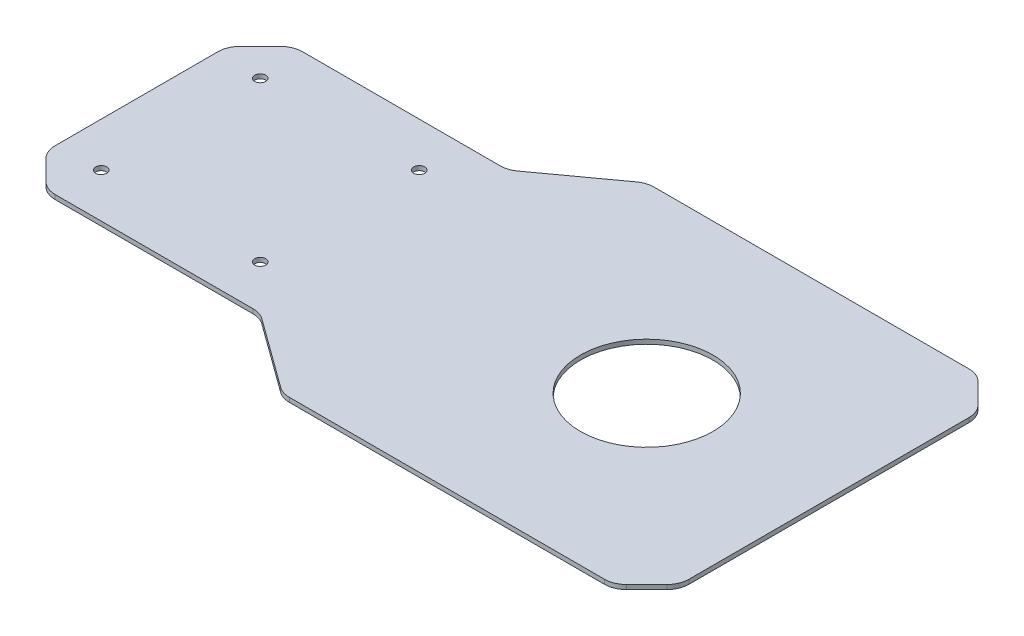
from build123d import *

# Parameters (mm, degrees)
BOSS_EXTRUDE1_DEPTH = 2
CHAMFER1_SIZE       = 15
FILLET1_R           = 10
SKETCH3_R           = 2.5
SKETCH3_R_2         = 30
CUT_EXTRUDE1_DEPTH  = 271.400628697


with BuildPart() as part:
    # Sketch2 → Boss-Extrude1 (new body)
    with BuildSketch(Plane(origin=(0, 0, 0), x_dir=(1, 0, 0), z_dir=(0, 1, 0))):
        Polygon((56, 56), (92.5, 82.5), (257.5, 82.5), (257.5, -82.5), (92.5, -82.5), (56, -56), (-56, -56), (-56, 56), align=None)
    extrude(amount=BOSS_EXTRUDE1_DEPTH)

    # Chamfer1
    chamfer1_edges = [part.edges().sort_by_distance(p)[0] for p in [
        (257.5, 1, 82.5),
        (-56, 1, 56),
        (-56, 1, -56),
        (257.5, 1, -82.5),
    ]]
    chamfer(chamfer1_edges, length=CHAMFER1_SIZE)

    # Fillet1
    fillet1_edges = [part.edges().sort_by_distance(p)[0] for p in [
        (92.5, 1, 82.5),
        (56, 1, 56),
        (56, 1, -56),
        (92.5, 1, -82.5),
        (-56, 1, 41),
        (-56, 1, -41),
        (-41, 1, -56),
        (-41, 1, 56),
        (242.5, 1, -82.5),
        (257.5, 1, 67.5),
        (257.5, 1, -67.5),
        (242.5, 1, 82.5),
    ]]
    fillet(fillet1_edges, radius=FILLET1_R)

    # Sketch3 → Cut-Extrude1 (cut, through all)
    with BuildSketch(Plane(origin=(0, 2, 0), x_dir=(1, 0, 0), z_dir=(0, 1, 0))):
        with Locations(Location((36, 36, 0), (0, 0, 270))):
            Circle(SKETCH3_R)
        with Locations(Location((-36, 36, 0), (0, 0, 270))):
            Circle(SKETCH3_R)
        with Locations(Location((-36, -36, 0), (0, 0, 270))):
            Circle(SKETCH3_R)
        with Locations(Location((36, -36, 0), (0, 0, 270))):
            Circle(SKETCH3_R)
        with Locations(Location((175, 0, 0), (0, 0, 270))):
            Circle(SKETCH3_R_2)
    extrude(amount=-CUT_EXTRUDE1_DEPTH, mode=Mode.SUBTRACT)


solid = part.part
